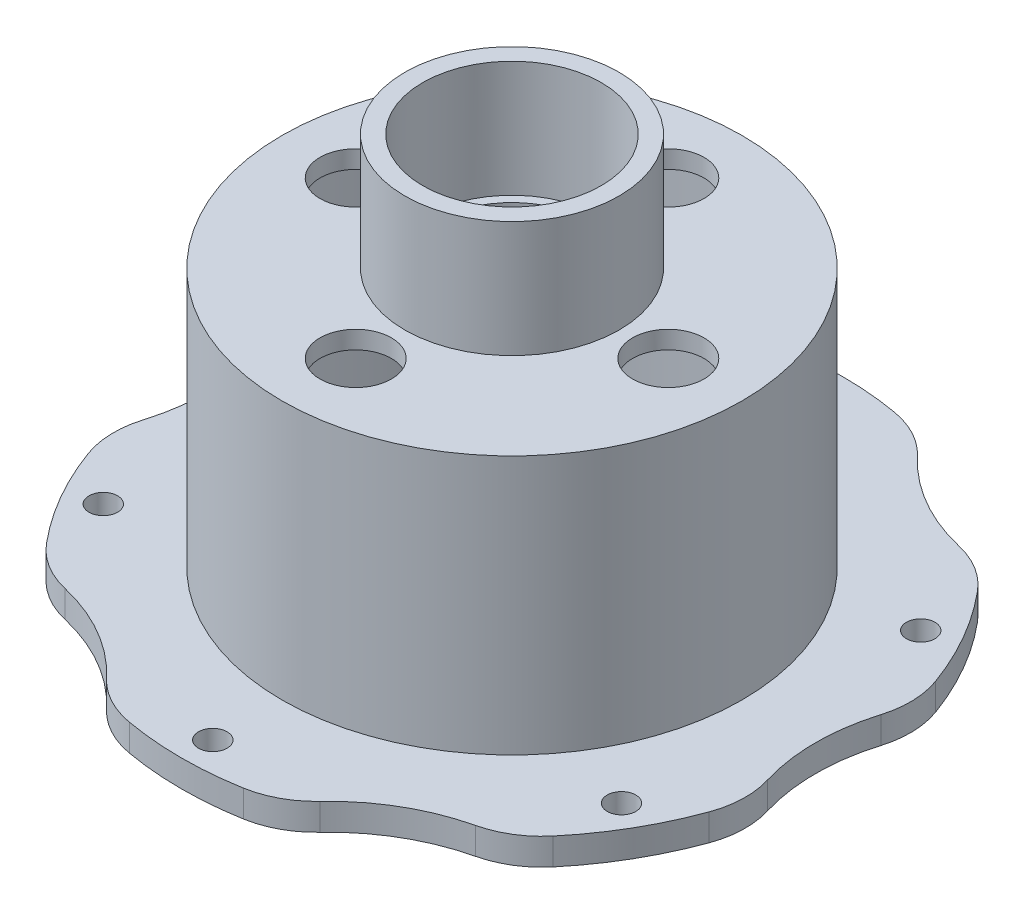
from build123d import *

# Parameters (mm, degrees)
SKETCH_1_R               = 25.75
SKETCH_1_R_2             = 24
EXTRUDE_1_DEPTH          = 30
SKETCH_2_R               = 37
SKETCH_2_R_2             = 24
EXTRUDE_2_DEPTH          = 3
SKETCH_3_R               = 29
CUT_EXTRUDE_1_DEPTH      = 1
SKETCH_4_R               = 1.6
CUT_EXTRUDE_2_DEPTH      = 21
PATTERN_CIRCULAR_1_COUNT = 6
SKETCH_5_R               = 22
CUT_EXTRUDE_3_DEPTH      = 11
PATTERN_CIRCULAR_2_COUNT = 6
SKETCH_6_R               = 25.75
SKETCH_6_R_2             = 10
EXTRUDE_3_DEPTH          = 2
SKETCH_7_R               = 12
SKETCH_7_R_2             = 10
EXTRUDE_4_DEPTH          = 13
SKETCH_8_R               = 4
CUT_EXTRUDE_5_DEPTH      = 15.3
PATTERN_CIRCULAR_4_COUNT = 4
SKETCH_9_R               = 10
SKETCH_9_R_2             = 9
EXTRUDE_5_DEPTH          = 2
FILLET_1_R               = 10


with BuildPart() as part:
    # 草图1 → 凸台-拉伸1 (new body)
    with BuildSketch(Plane(origin=(0, 0, 0), x_dir=(1, 0, 0), z_dir=(0, 1, 0))):
        with Locations(Location((0, 0, 0), (0, 0, 270))):
            Circle(SKETCH_1_R)
        with Locations(Location((0, 0, 0), (0, 0, 270))):
            Circle(SKETCH_1_R_2, mode=Mode.SUBTRACT)
    extrude(amount=EXTRUDE_1_DEPTH)

    # 草图2 → 凸台-拉伸2 (add)
    with BuildSketch(Plane.XZ):
        with Locations(Location((0, 0, 0), (0, 0, 270))):
            Circle(SKETCH_2_R)
        with Locations(Location((0, 0, 0), (0, 0, 90))):
            Circle(SKETCH_2_R_2, mode=Mode.SUBTRACT)
    extrude(amount=-EXTRUDE_2_DEPTH)

    # 草图3 → 切除-拉伸1 (cut)
    with BuildSketch(Plane.XZ):
        with Locations(Location((0, 0, 0), (0, 0, 270))):
            Circle(SKETCH_3_R)
    extrude(amount=-CUT_EXTRUDE_1_DEPTH, mode=Mode.SUBTRACT)

    # 草图4 → 切除-拉伸2 (cut)
    with BuildSketch(Plane(origin=(0, 3, 0), x_dir=(1, 0, 0), z_dir=(0, 1, 0))):
        with Locations(Location((0, 33.5, 0), (0, 0, 270))):
            Circle(SKETCH_4_R)
    cut_extrude_2 = extrude(amount=-CUT_EXTRUDE_2_DEPTH, mode=Mode.SUBTRACT)

    # 阵列(圆周)1: 切除-拉伸2 ×6 about axis
    pattern_circular_1_axis = Axis((0, 0, 0), (0, 1, 0))
    for i in range(1, PATTERN_CIRCULAR_1_COUNT):
        add(cut_extrude_2.rotate(pattern_circular_1_axis, i * 360 / PATTERN_CIRCULAR_1_COUNT), mode=Mode.SUBTRACT)

    # 草图5 → 切除-拉伸3 (cut)
    with BuildSketch(Plane.XZ):
        with Locations((56, 0)):
            Circle(SKETCH_5_R)
    cut_extrude_3 = extrude(amount=-CUT_EXTRUDE_3_DEPTH, mode=Mode.SUBTRACT)

    # 阵列(圆周)2: 切除-拉伸3 ×6 about axis
    pattern_circular_2_axis = Axis((0, 0, 0), (0, 1, 0))
    for i in range(1, PATTERN_CIRCULAR_2_COUNT):
        add(cut_extrude_3.rotate(pattern_circular_2_axis, i * 360 / PATTERN_CIRCULAR_2_COUNT), mode=Mode.SUBTRACT)

    # 草图6 → 凸台-拉伸3 (add)
    with BuildSketch(Plane(origin=(0, 30, 0), x_dir=(1, 0, 0), z_dir=(0, 1, 0))):
        with Locations(Location((0, 0, 0), (0, 0, 90))):
            Circle(SKETCH_6_R)
        with Locations(Location((0, 0, 0), (0, 0, 270))):
            Circle(SKETCH_6_R_2, mode=Mode.SUBTRACT)
    extrude(amount=EXTRUDE_3_DEPTH)

    # 草图7 → 凸台-拉伸4 (add)
    with BuildSketch(Plane(origin=(0, 32, 0), x_dir=(1, 0, 0), z_dir=(0, 1, 0))):
        with Locations(Location((0, 0, 0), (0, 0, 90))):
            Circle(SKETCH_7_R)
        with Locations(Location((0, 0, 0), (0, 0, 270))):
            Circle(SKETCH_7_R_2, mode=Mode.SUBTRACT)
    extrude(amount=EXTRUDE_4_DEPTH)

    # 草图8 → 切除-拉伸5 (cut)
    with BuildSketch(Plane(origin=(0, 32, 0), x_dir=(1, 0, 0), z_dir=(0, 1, 0))):
        with Locations(Location((0, 17.5, 0), (0, 0, 270))):
            Circle(SKETCH_8_R)
    cut_extrude_5 = extrude(amount=-CUT_EXTRUDE_5_DEPTH, mode=Mode.SUBTRACT)

    # 阵列(圆周)4: 切除-拉伸5 ×4 about axis
    pattern_circular_4_axis = Axis((0, 0, 0), (0, 1, 0))
    for i in range(1, PATTERN_CIRCULAR_4_COUNT):
        add(cut_extrude_5.rotate(pattern_circular_4_axis, i * 360 / PATTERN_CIRCULAR_4_COUNT), mode=Mode.SUBTRACT)

    # 草图9 → 凸台-拉伸5 (add)
    with BuildSketch(Plane.XZ.offset(-30)):
        with Locations(Location((0, 0, 0), (0, 0, 270))):
            Circle(SKETCH_9_R)
        with Locations(Location((0, 0, 0), (0, 0, 270))):
            Circle(SKETCH_9_R_2, mode=Mode.SUBTRACT)
    extrude(amount=-EXTRUDE_5_DEPTH)

    # 圆角1
    fillet_1_edges = [part.edges().sort_by_distance(p)[0] for p in [
        (35.901785714, 1.5, -8.947724992),
        (35.901785714, 1.5, 8.947724992),
        (25.699850006, 1.5, 26.617995974),
        (10.201935708, 1.5, 35.565720966),
        (-10.201935708, 1.5, 35.565720966),
        (-25.699850006, 1.5, 26.617995974),
        (-35.901785714, 1.5, 8.947724992),
        (-35.901785714, 1.5, -8.947724992),
        (-25.699850006, 1.5, -26.617995974),
        (-10.201935708, 1.5, -35.565720966),
        (10.201935708, 1.5, -35.565720966),
        (25.699850006, 1.5, -26.617995974),
    ]]
    fillet(fillet_1_edges, radius=FILLET_1_R)


solid = part.part
